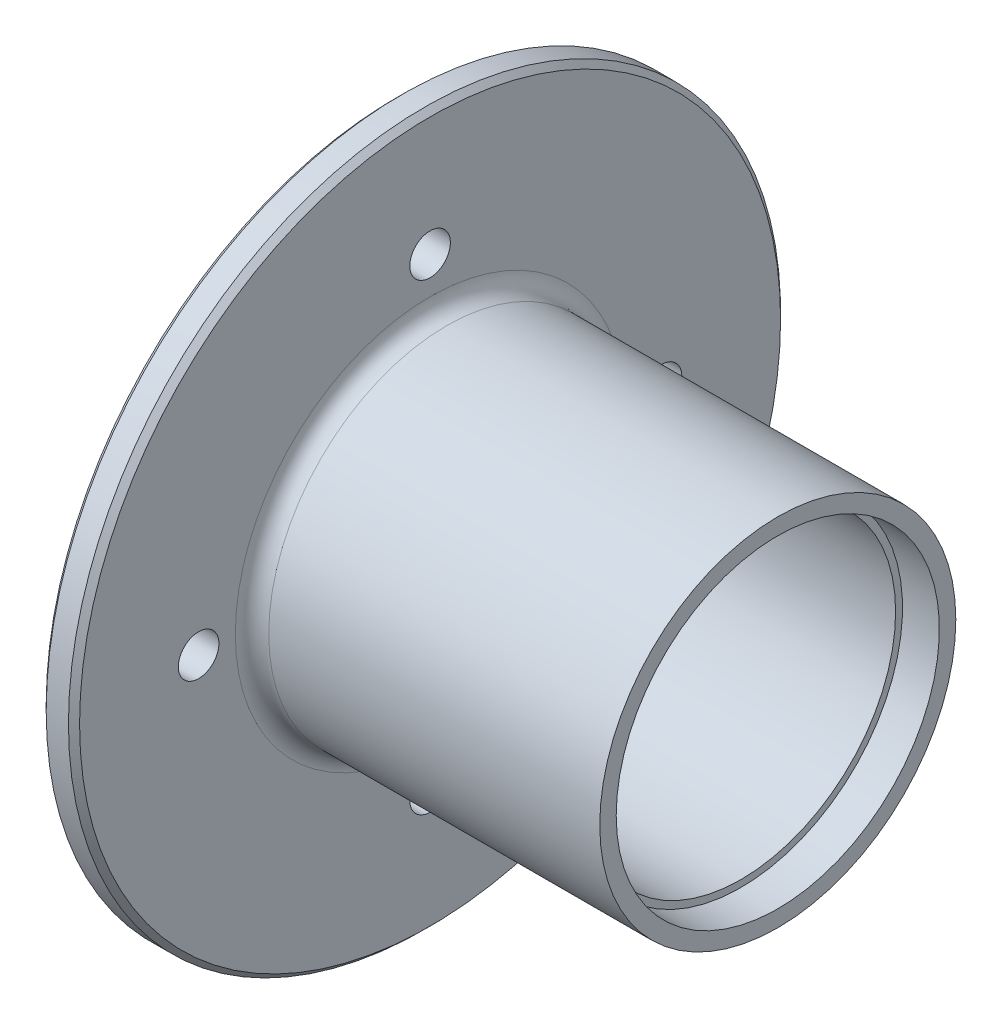
from build123d import *

# Parameters (mm, degrees)
D_GAGEMENT_121_D             = 5.7912
R_P_TITION_CIRCULAIRE1_COUNT = 4


with BuildPart() as part:
    # Model → Révolution1 (revolve)
    with BuildSketch(Plane.XY):
        with BuildLine():
            Line((3.3455884, 17.143351136), (8.1080884, 12.547042688))
            Line((8.1080884, 12.547042688), (8.1080884, 17.143351136))
            Line((8.1080884, 17.143351136), (23.54842405, 17.143351136))
            Line((23.54842405, 17.143351136), (23.54842405, 22.067968078))
            Line((23.54842405, 22.067968078), (52.457988292, 22.067968078))
            Line((52.457988292, 22.067968078), (52.457988292, 23.05289127))
            Line((52.457988292, 23.05289127), (57.714273081, 23.05289127))
            Line((57.714273081, 23.05289127), (57.714273081, 25.4))
            Line((57.714273081, 25.4), (10.4893384, 25.4))
            ThreePointArc((10.4893384, 25.4), (8.805540377, 26.097451977), (8.1080884, 27.78125))
            Line((8.1080884, 27.78125), (8.1080884, 50.00625))
            Line((8.1080884, 50.00625), (7.3143384, 50.8))
            Line((7.3143384, 50.8), (4.1393384, 50.8))
            Line((4.1393384, 50.8), (3.3455884, 50.00625))
            Line((3.3455884, 50.00625), (3.3455884, 17.143351136))
        make_face()
    revolve(axis=Axis((0, 0, 0), (1, 0, 0)))

    # Dégagement #121 (through all)
    with Locations(Plane(origin=(8.1080884, 0, 0), x_dir=(0, 0, -1), z_dir=(1, 0, 0))):
        with Locations((0, 33.02)):
            d_gagement_121 = Hole(D_GAGEMENT_121_D / 2)

    # Répétition circulaire1: Dégagement #121 ×4 about axis
    r_p_tition_circulaire1_axis = Axis((57.714273081, 0, 0), (-1, 0, 0))
    for i in range(1, R_P_TITION_CIRCULAIRE1_COUNT):
        add(d_gagement_121.rotate(r_p_tition_circulaire1_axis, i * 360 / R_P_TITION_CIRCULAIRE1_COUNT), mode=Mode.SUBTRACT)


solid = part.part
